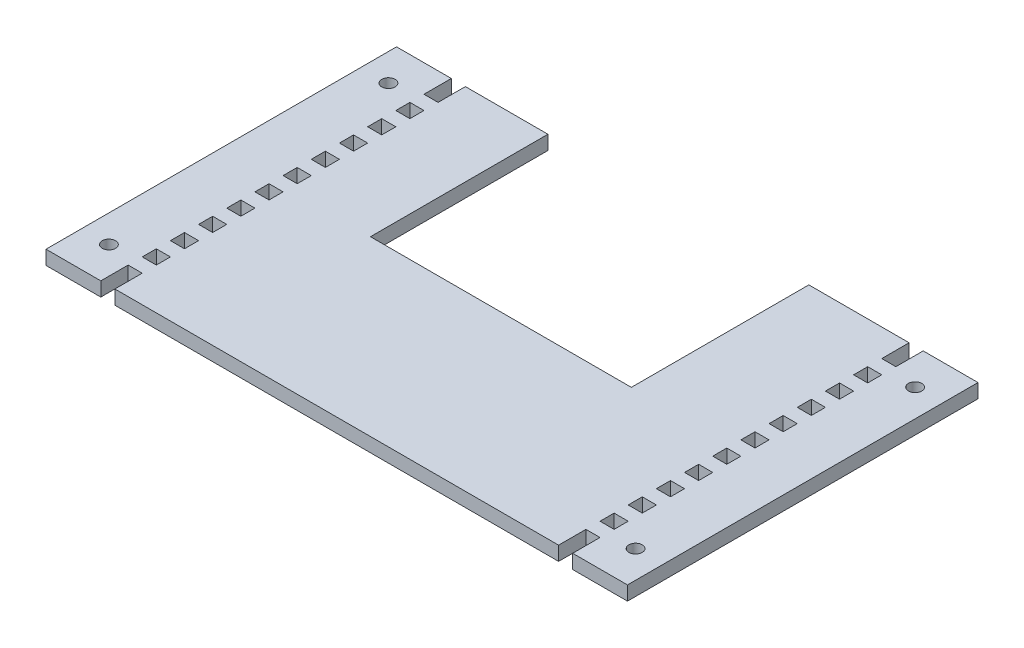
from build123d import *

# Parameters (mm, degrees)
SKETCH3_W                     = 100
SKETCH3_H                     = 79
BOSS_EXTRUDE1_DEPTH           = 3.175
SKETCH5_W                     = 58.8
SKETCH5_H                     = 40
CUT_EXTRUDE2_DEPTH            = 3.175
SKETCH11_W                    = 6.35
SKETCH11_H                    = 3.175
BOSS_EXTRUDE2_DEPTH           = 3.175
LPATTERN2_COUNT               = 6
LPATTERN2_PITCH               = 6.35
LPATTERN2_COPY_1_SKETCH_W     = 6.35
LPATTERN2_COPY_1_SKETCH_H     = 3.175
LPATTERN2_COPY_1_DEPTH        = 3.175
LPATTERN2_COPY_2_SKETCH_W     = 6.35
LPATTERN2_COPY_2_SKETCH_H     = 3.175
LPATTERN2_COPY_2_DEPTH        = 3.175
LPATTERN2_COPY_3_SKETCH_W     = 6.35
LPATTERN2_COPY_3_SKETCH_H     = 3.175
LPATTERN2_COPY_3_DEPTH        = 3.175
LPATTERN2_COPY_4_SKETCH_W     = 6.35
LPATTERN2_COPY_4_SKETCH_H     = 3.175
LPATTERN2_COPY_4_DEPTH        = 3.175
LPATTERN2_COPY_5_SKETCH_W     = 6.35
LPATTERN2_COPY_5_SKETCH_H     = 3.175
LPATTERN2_COPY_5_DEPTH        = 3.175
LPATTERN2_COL_COUNT           = 6
LPATTERN2_COL_PITCH           = 6.35
LPATTERN2_COL_COPY_1_SKETCH_W = 6.35
LPATTERN2_COL_COPY_1_SKETCH_H = 3.175
LPATTERN2_COL_COPY_1_DEPTH    = 3.175
LPATTERN2_COL_COPY_2_SKETCH_W = 6.35
LPATTERN2_COL_COPY_2_SKETCH_H = 3.175
LPATTERN2_COL_COPY_2_DEPTH    = 3.175
LPATTERN2_COL_COPY_3_SKETCH_W = 6.35
LPATTERN2_COL_COPY_3_SKETCH_H = 3.175
LPATTERN2_COL_COPY_3_DEPTH    = 3.175
LPATTERN2_COL_COPY_4_SKETCH_W = 6.35
LPATTERN2_COL_COPY_4_SKETCH_H = 3.175
LPATTERN2_COL_COPY_4_DEPTH    = 3.175
LPATTERN2_COL_COPY_5_SKETCH_W = 6.35
LPATTERN2_COL_COPY_5_SKETCH_H = 3.175
LPATTERN2_COL_COPY_5_DEPTH    = 3.175
SKETCH13_W                    = 12.35
SKETCH13_H                    = 79
BOSS_EXTRUDE4_DEPTH           = 3.175
SKETCH14_W                    = 12.35
SKETCH14_H                    = 79
BOSS_EXTRUDE5_DEPTH           = 3.175
SKETCH15_R                    = 1.5
CUT_EXTRUDE4_DEPTH            = 10
SKETCH16_R                    = 1.5
CUT_EXTRUDE5_DEPTH            = 10


with BuildPart() as part:
    # Sketch3 → Boss-Extrude1 (new body)
    with BuildSketch(Plane(origin=(0, 0, 0), x_dir=(1, 0, 0), z_dir=(0, 1, 0))):
        with Locations((46, 22.5)):
            Rectangle(SKETCH3_W, SKETCH3_H)
    extrude(amount=BOSS_EXTRUDE1_DEPTH)

    # Sketch5 → Cut-Extrude2 (cut)
    with BuildSketch(Plane(origin=(0, 3.175, 0), x_dir=(1, 0, 0), z_dir=(0, 1, 0))):
        with Locations((44, 42)):
            Rectangle(SKETCH5_W, SKETCH5_H)
    extrude(amount=-CUT_EXTRUDE2_DEPTH, mode=Mode.SUBTRACT)

    # Sketch11 → Boss-Extrude2 (add)
    with BuildSketch(Plane(origin=(0, 3.175, 0), x_dir=(1, 0, 0), z_dir=(0, 1, 0))):
        with Locations((-4, 22.5)):
            Rectangle(SKETCH11_W, SKETCH11_H)
    boss_extrude2 = extrude(amount=-BOSS_EXTRUDE2_DEPTH)

    # Mirror2: Boss-Extrude2 across plane
    add(boss_extrude2.mirror(Plane.ZY.offset(-46)))

    # LPattern2: Boss-Extrude2 ×6
    with Locations(*[(0, 0, -i * LPATTERN2_PITCH) for i in range(1, LPATTERN2_COUNT)]):
        add(boss_extrude2)

    # LPattern2 copy 1 sketch → LPattern2 copy 1 (add)
    with BuildSketch(Plane(origin=(92, 3.175, -6.35), x_dir=(-1, 0, 0), z_dir=(0, 1, 0))):
        with Locations((-4, -22.5)):
            Rectangle(LPATTERN2_COPY_1_SKETCH_W, LPATTERN2_COPY_1_SKETCH_H)
    extrude(amount=-LPATTERN2_COPY_1_DEPTH)

    # LPattern2 copy 2 sketch → LPattern2 copy 2 (add)
    with BuildSketch(Plane(origin=(92, 3.175, -12.7), x_dir=(-1, 0, 0), z_dir=(0, 1, 0))):
        with Locations((-4, -22.5)):
            Rectangle(LPATTERN2_COPY_2_SKETCH_W, LPATTERN2_COPY_2_SKETCH_H)
    extrude(amount=-LPATTERN2_COPY_2_DEPTH)

    # LPattern2 copy 3 sketch → LPattern2 copy 3 (add)
    with BuildSketch(Plane(origin=(92, 3.175, -19.05), x_dir=(-1, 0, 0), z_dir=(0, 1, 0))):
        with Locations((-4, -22.5)):
            Rectangle(LPATTERN2_COPY_3_SKETCH_W, LPATTERN2_COPY_3_SKETCH_H)
    extrude(amount=-LPATTERN2_COPY_3_DEPTH)

    # LPattern2 copy 4 sketch → LPattern2 copy 4 (add)
    with BuildSketch(Plane(origin=(92, 3.175, -25.4), x_dir=(-1, 0, 0), z_dir=(0, 1, 0))):
        with Locations((-4, -22.5)):
            Rectangle(LPATTERN2_COPY_4_SKETCH_W, LPATTERN2_COPY_4_SKETCH_H)
    extrude(amount=-LPATTERN2_COPY_4_DEPTH)

    # LPattern2 copy 5 sketch → LPattern2 copy 5 (add)
    with BuildSketch(Plane(origin=(92, 3.175, -31.75), x_dir=(-1, 0, 0), z_dir=(0, 1, 0))):
        with Locations((-4, -22.5)):
            Rectangle(LPATTERN2_COPY_5_SKETCH_W, LPATTERN2_COPY_5_SKETCH_H)
    extrude(amount=-LPATTERN2_COPY_5_DEPTH)

    # LPattern2 col: Boss-Extrude2 ×6
    with Locations(*[(0, 0, i * LPATTERN2_COL_PITCH) for i in range(1, LPATTERN2_COL_COUNT)]):
        add(boss_extrude2)

    # LPattern2 col copy 1 sketch → LPattern2 col copy 1 (add)
    with BuildSketch(Plane(origin=(92, 3.175, 6.35), x_dir=(-1, 0, 0), z_dir=(0, 1, 0))):
        with Locations((-4, -22.5)):
            Rectangle(LPATTERN2_COL_COPY_1_SKETCH_W, LPATTERN2_COL_COPY_1_SKETCH_H)
    extrude(amount=-LPATTERN2_COL_COPY_1_DEPTH)

    # LPattern2 col copy 2 sketch → LPattern2 col copy 2 (add)
    with BuildSketch(Plane(origin=(92, 3.175, 12.7), x_dir=(-1, 0, 0), z_dir=(0, 1, 0))):
        with Locations((-4, -22.5)):
            Rectangle(LPATTERN2_COL_COPY_2_SKETCH_W, LPATTERN2_COL_COPY_2_SKETCH_H)
    extrude(amount=-LPATTERN2_COL_COPY_2_DEPTH)

    # LPattern2 col copy 3 sketch → LPattern2 col copy 3 (add)
    with BuildSketch(Plane(origin=(92, 3.175, 19.05), x_dir=(-1, 0, 0), z_dir=(0, 1, 0))):
        with Locations((-4, -22.5)):
            Rectangle(LPATTERN2_COL_COPY_3_SKETCH_W, LPATTERN2_COL_COPY_3_SKETCH_H)
    extrude(amount=-LPATTERN2_COL_COPY_3_DEPTH)

    # LPattern2 col copy 4 sketch → LPattern2 col copy 4 (add)
    with BuildSketch(Plane(origin=(92, 3.175, 25.4), x_dir=(-1, 0, 0), z_dir=(0, 1, 0))):
        with Locations((-4, -22.5)):
            Rectangle(LPATTERN2_COL_COPY_4_SKETCH_W, LPATTERN2_COL_COPY_4_SKETCH_H)
    extrude(amount=-LPATTERN2_COL_COPY_4_DEPTH)

    # LPattern2 col copy 5 sketch → LPattern2 col copy 5 (add)
    with BuildSketch(Plane(origin=(92, 3.175, 31.75), x_dir=(-1, 0, 0), z_dir=(0, 1, 0))):
        with Locations((-4, -22.5)):
            Rectangle(LPATTERN2_COL_COPY_5_SKETCH_W, LPATTERN2_COL_COPY_5_SKETCH_H)
    extrude(amount=-LPATTERN2_COL_COPY_5_DEPTH)

    # Sketch13 → Boss-Extrude4 (add)
    with BuildSketch(Plane(origin=(0, 3.175, 0), x_dir=(1, 0, 0), z_dir=(0, 1, 0))):
        with Locations((-13.35, 22.5)):
            Rectangle(SKETCH13_W, SKETCH13_H)
    extrude(amount=-BOSS_EXTRUDE4_DEPTH)

    # Sketch14 → Boss-Extrude5 (add)
    with BuildSketch(Plane(origin=(0, 3.175, 0), x_dir=(1, 0, 0), z_dir=(0, 1, 0))):
        with Locations((105.35, 22.5)):
            Rectangle(SKETCH14_W, SKETCH14_H)
    extrude(amount=-BOSS_EXTRUDE5_DEPTH)

    # Sketch15 → Cut-Extrude4 (cut)
    with BuildSketch(Plane(origin=(0, 3.175, 0), x_dir=(1, 0, 0), z_dir=(0, 1, 0))):
        with Locations(Location((-13.35, 54, 0), (0, 0, 270))):
            Circle(SKETCH15_R)
        with Locations(Location((-13.35, -9, 0), (0, 0, 270))):
            Circle(SKETCH15_R)
    extrude(amount=-CUT_EXTRUDE4_DEPTH, mode=Mode.SUBTRACT)

    # Sketch16 → Cut-Extrude5 (cut)
    with BuildSketch(Plane(origin=(0, 3.175, 0), x_dir=(1, 0, 0), z_dir=(0, 1, 0))):
        with Locations(Location((105.35, 54, 0), (0, 0, 270))):
            Circle(SKETCH16_R)
        with Locations(Location((105.35, -9, 0), (0, 0, 270))):
            Circle(SKETCH16_R)
    extrude(amount=-CUT_EXTRUDE5_DEPTH, mode=Mode.SUBTRACT)


solid = part.part
